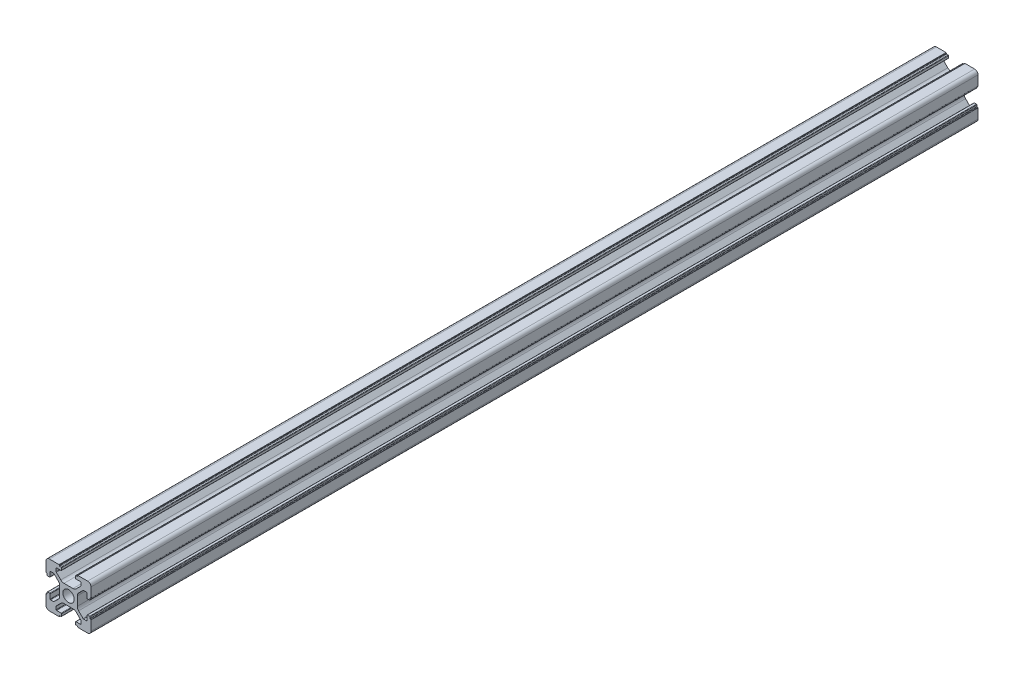
from build123d import *

# Parameters (mm, degrees)
SKETCH1_R           = 2.5
BOSS_EXTRUDE1_DEPTH = 394


with BuildPart() as part:
    # Sketch1 → Boss-Extrude1 (new body)
    with BuildSketch(Plane(origin=(0, 0, 0), x_dir=(1, 0, 0), z_dir=(0, 0, -1))):
        with BuildLine():
            Line((1.5, 0), (5.8, 0))
            ThreePointArc((5.8, 0), (5.870710678, 0.029289322), (5.9, 0.1))
            Line((5.9, 0.1), (5.9, 0.3))
            ThreePointArc((5.9, 0.3), (5.958578644, 0.441421356), (6.1, 0.5))
            Line((6.1, 0.5), (6.7, 0.5))
            ThreePointArc((6.7, 0.5), (6.841421356, 0.558578644), (6.9, 0.7))
            Line((6.9, 0.7), (6.9, 1.6))
            ThreePointArc((6.9, 1.6), (6.841421356, 1.741421356), (6.7, 1.8))
            Line((6.7, 1.8), (4.7, 1.8))
            ThreePointArc((4.7, 1.8), (4.558578644, 1.858578644), (4.5, 2))
            Line((4.5, 2), (4.5, 3.31507576))
            ThreePointArc((4.5, 3.31507576), (4.52283614, 3.429880789), (4.587867966, 3.527207794))
            Line((4.587867966, 3.527207794), (6.574873734, 5.514213562))
            ThreePointArc((6.574873734, 5.514213562), (7.223720432, 5.947759065), (7.989087297, 6.1))
            Line((7.989087297, 6.1), (12.010912703, 6.1))
            ThreePointArc((12.010912703, 6.1), (12.776279568, 5.947759065), (13.425126266, 5.514213562))
            Line((13.425126266, 5.514213562), (15.412132034, 3.527207794))
            ThreePointArc((15.412132034, 3.527207794), (15.47716386, 3.429880789), (15.5, 3.31507576))
            Line((15.5, 3.31507576), (15.5, 2))
            ThreePointArc((15.5, 2), (15.441421356, 1.858578644), (15.3, 1.8))
            Line((15.3, 1.8), (13.3, 1.8))
            ThreePointArc((13.3, 1.8), (13.158578644, 1.741421356), (13.1, 1.6))
            Line((13.1, 1.6), (13.1, 0.7))
            ThreePointArc((13.1, 0.7), (13.158578644, 0.558578644), (13.3, 0.5))
            Line((13.3, 0.5), (13.9, 0.5))
            ThreePointArc((13.9, 0.5), (14.041421356, 0.441421356), (14.1, 0.3))
            Line((14.1, 0.3), (14.1, 0.1))
            ThreePointArc((14.1, 0.1), (14.129289322, 0.029289322), (14.2, 0))
            Line((14.2, 0), (18.5, 0))
            ThreePointArc((18.5, 0), (19.560660172, 0.439339828), (20, 1.5))
            Line((20, 1.5), (20, 5.8))
            ThreePointArc((20, 5.8), (19.970710678, 5.870710678), (19.9, 5.9))
            Line((19.9, 5.9), (19.7, 5.9))
            ThreePointArc((19.7, 5.9), (19.558578644, 5.958578644), (19.5, 6.1))
            Line((19.5, 6.1), (19.5, 6.7))
            ThreePointArc((19.5, 6.7), (19.441421356, 6.841421356), (19.3, 6.9))
            Line((19.3, 6.9), (18.4, 6.9))
            ThreePointArc((18.4, 6.9), (18.258578644, 6.841421356), (18.2, 6.7))
            Line((18.2, 6.7), (18.2, 4.7))
            ThreePointArc((18.2, 4.7), (18.141421356, 4.558578644), (18, 4.5))
            Line((18, 4.5), (16.68492424, 4.5))
            ThreePointArc((16.68492424, 4.5), (16.570119211, 4.52283614), (16.472792206, 4.587867966))
            Line((16.472792206, 4.587867966), (14.485786438, 6.574873734))
            ThreePointArc((14.485786438, 6.574873734), (14.052240935, 7.223720432), (13.9, 7.989087297))
            Line((13.9, 7.989087297), (13.9, 12.010912703))
            ThreePointArc((13.9, 12.010912703), (14.052240935, 12.776279568), (14.485786438, 13.425126266))
            Line((14.485786438, 13.425126266), (16.472792206, 15.412132034))
            ThreePointArc((16.472792206, 15.412132034), (16.570119211, 15.47716386), (16.68492424, 15.5))
            Line((16.68492424, 15.5), (18, 15.5))
            ThreePointArc((18, 15.5), (18.141421356, 15.441421356), (18.2, 15.3))
            Line((18.2, 15.3), (18.2, 13.3))
            ThreePointArc((18.2, 13.3), (18.258578644, 13.158578644), (18.4, 13.1))
            Line((18.4, 13.1), (19.3, 13.1))
            ThreePointArc((19.3, 13.1), (19.441421356, 13.158578644), (19.5, 13.3))
            Line((19.5, 13.3), (19.5, 13.9))
            ThreePointArc((19.5, 13.9), (19.558578644, 14.041421356), (19.7, 14.1))
            Line((19.7, 14.1), (19.9, 14.1))
            ThreePointArc((19.9, 14.1), (19.970710678, 14.129289322), (20, 14.2))
            Line((20, 14.2), (20, 18.5))
            ThreePointArc((20, 18.5), (19.560660172, 19.560660172), (18.5, 20))
            Line((18.5, 20), (14.2, 20))
            ThreePointArc((14.2, 20), (14.129289322, 19.970710678), (14.1, 19.9))
            Line((14.1, 19.9), (14.1, 19.7))
            ThreePointArc((14.1, 19.7), (14.041421356, 19.558578644), (13.9, 19.5))
            Line((13.9, 19.5), (13.3, 19.5))
            ThreePointArc((13.3, 19.5), (13.158578644, 19.441421356), (13.1, 19.3))
            Line((13.1, 19.3), (13.1, 18.4))
            ThreePointArc((13.1, 18.4), (13.158578644, 18.258578644), (13.3, 18.2))
            Line((13.3, 18.2), (15.3, 18.2))
            ThreePointArc((15.3, 18.2), (15.441421356, 18.141421356), (15.5, 18))
            Line((15.5, 18), (15.5, 16.68492424))
            ThreePointArc((15.5, 16.68492424), (15.47716386, 16.570119211), (15.412132034, 16.472792206))
            Line((15.412132034, 16.472792206), (13.425126266, 14.485786438))
            ThreePointArc((13.425126266, 14.485786438), (12.776279568, 14.052240935), (12.010912703, 13.9))
            Line((12.010912703, 13.9), (7.989087297, 13.9))
            ThreePointArc((7.989087297, 13.9), (7.223720432, 14.052240935), (6.574873734, 14.485786438))
            Line((6.574873734, 14.485786438), (4.587867966, 16.472792206))
            ThreePointArc((4.587867966, 16.472792206), (4.52283614, 16.570119211), (4.5, 16.68492424))
            Line((4.5, 16.68492424), (4.5, 18))
            ThreePointArc((4.5, 18), (4.558578644, 18.141421356), (4.7, 18.2))
            Line((4.7, 18.2), (6.7, 18.2))
            ThreePointArc((6.7, 18.2), (6.841421356, 18.258578644), (6.9, 18.4))
            Line((6.9, 18.4), (6.9, 19.3))
            ThreePointArc((6.9, 19.3), (6.841421356, 19.441421356), (6.7, 19.5))
            Line((6.7, 19.5), (6.1, 19.5))
            ThreePointArc((6.1, 19.5), (5.958578644, 19.558578644), (5.9, 19.7))
            Line((5.9, 19.7), (5.9, 19.9))
            ThreePointArc((5.9, 19.9), (5.870710678, 19.970710678), (5.8, 20))
            Line((5.8, 20), (1.5, 20))
            ThreePointArc((1.5, 20), (0.439339828, 19.560660172), (0, 18.5))
            Line((0, 18.5), (0, 14.2))
            ThreePointArc((0, 14.2), (0.029289322, 14.129289322), (0.1, 14.1))
            Line((0.1, 14.1), (0.3, 14.1))
            ThreePointArc((0.3, 14.1), (0.441421356, 14.041421356), (0.5, 13.9))
            Line((0.5, 13.9), (0.5, 13.3))
            ThreePointArc((0.5, 13.3), (0.558578644, 13.158578644), (0.7, 13.1))
            Line((0.7, 13.1), (1.6, 13.1))
            ThreePointArc((1.6, 13.1), (1.741421356, 13.158578644), (1.8, 13.3))
            Line((1.8, 13.3), (1.8, 15.3))
            ThreePointArc((1.8, 15.3), (1.858578644, 15.441421356), (2, 15.5))
            Line((2, 15.5), (3.31507576, 15.5))
            ThreePointArc((3.31507576, 15.5), (3.429880789, 15.47716386), (3.527207794, 15.412132034))
            Line((3.527207794, 15.412132034), (5.514213562, 13.425126266))
            ThreePointArc((5.514213562, 13.425126266), (5.947759065, 12.776279568), (6.1, 12.010912703))
            Line((6.1, 12.010912703), (6.1, 7.989087297))
            ThreePointArc((6.1, 7.989087297), (5.947759065, 7.223720432), (5.514213562, 6.574873734))
            Line((5.514213562, 6.574873734), (3.527207794, 4.587867966))
            ThreePointArc((3.527207794, 4.587867966), (3.429880789, 4.52283614), (3.31507576, 4.5))
            Line((3.31507576, 4.5), (2, 4.5))
            ThreePointArc((2, 4.5), (1.858578644, 4.558578644), (1.8, 4.7))
            Line((1.8, 4.7), (1.8, 6.7))
            ThreePointArc((1.8, 6.7), (1.741421356, 6.841421356), (1.6, 6.9))
            Line((1.6, 6.9), (0.7, 6.9))
            ThreePointArc((0.7, 6.9), (0.558578644, 6.841421356), (0.5, 6.7))
            Line((0.5, 6.7), (0.5, 6.1))
            ThreePointArc((0.5, 6.1), (0.441421356, 5.958578644), (0.3, 5.9))
            Line((0.3, 5.9), (0.1, 5.9))
            ThreePointArc((0.1, 5.9), (0.029289322, 5.870710678), (0, 5.8))
            Line((0, 5.8), (0, 1.5))
            ThreePointArc((0, 1.5), (0.439339828, 0.439339828), (1.5, 0))
        make_face()
        with Locations(Location((10, 10, 0), (0, 0, 180))):
            Circle(SKETCH1_R, mode=Mode.SUBTRACT)
    extrude(amount=BOSS_EXTRUDE1_DEPTH)


solid = part.part
